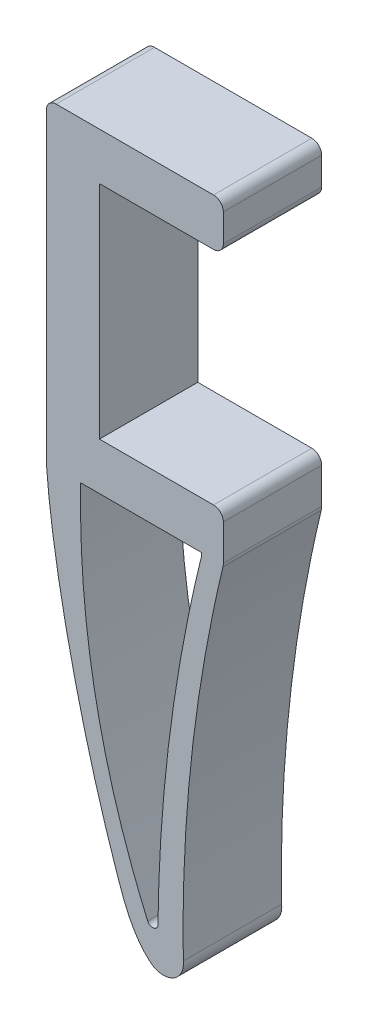
from build123d import *

# Parameters (mm, degrees)
EXTRUDE_1_DEPTH = 10
FILLET_2_R      = 1


with BuildPart() as part:
    # 草图1 → 凸台-拉伸1 (new body)
    with BuildSketch(Plane.XY):
        with BuildLine():
            Line((-1, 0), (-17, 0))
            ThreePointArc((-17, 0), (-17.707106781, -0.292893219), (-18, -1))
            Line((-18, -1), (-18, -32.1))
            add(Edge.make_bspline(
                [(-18, -32.1), (-17.398957494, -40.620033007), (-14.024039593, -56.364300347), (-9.146815425, -69.320325423), (-7.406396999, -70.788082272)],
                knots=[0, 0, 0, 0, 0.832203733, 1, 1, 1, 1], degree=3))
            ThreePointArc((-7.406396999, -70.788082272), (-5.133384432, -71.027159545), (-4.069948517, -69.004080671))
            add(Edge.make_bspline(
                [(-0.041239115, -32.271780397), (-1.500018129, -38.363838214), (-3.630248711, -50.577946078), (-4.185824398, -62.852038397), (-4.069948517, -69.004080671)],
                knots=[0.004175579, 0.004175579, 0.004175579, 0.004175579, 0.448416271, 0.892656962, 0.892656962, 0.892656962, 0.892656962], degree=3))
            ThreePointArc((-0.041239115, -32.271780397), (-0.010345455, -32.098338919), (0, -31.922471537))
            Line((0, -31.922471537), (0, -27.3))
            Line((0, -27.3), (-12.6, -27.3))
            Line((-12.6, -27.3), (-12.6, -4.8))
            Line((-12.6, -4.8), (0, -4.8))
            Line((0, -4.8), (0, -1))
            ThreePointArc((0, -1), (-0.292893219, -0.292893219), (-1, 0))
        make_face()
        with BuildLine():
            Line((-14.502921195, -32.1), (-2.20164077, -32.1))
            Line((-2.20164077, -32.1), (-2.20164077, -32.343989367))
            add(Edge.make_bspline(
                [(-2.20164077, -32.343989367), (-6.440587853, -49.539532595), (-6.646462239, -66.99036895)],
                knots=[0, 0, 0, 0.915733772, 0.915733772, 0.915733772], degree=2))
            ThreePointArc((-6.646462239, -66.99036895), (-7.041555359, -67.59672648), (-7.695713933, -67.28713871))
            add(Edge.make_bspline(
                [(-14.502921195, -32.1), (-14.753514705, -44.573225705), (-12.484445617, -56.302271942), (-7.695713933, -67.28713871)],
                knots=[0, 0, 0, 0, 1, 1, 1, 1], degree=3))
        make_face(mode=Mode.SUBTRACT)
    extrude(amount=EXTRUDE_1_DEPTH)

    # 圆角2
    fillet_2_edges = [part.edges().sort_by_distance(p)[0] for p in [
        (0, -4.8, 5),
        (0, -27.3, 5),
    ]]
    fillet(fillet_2_edges, radius=FILLET_2_R)


solid = part.part
